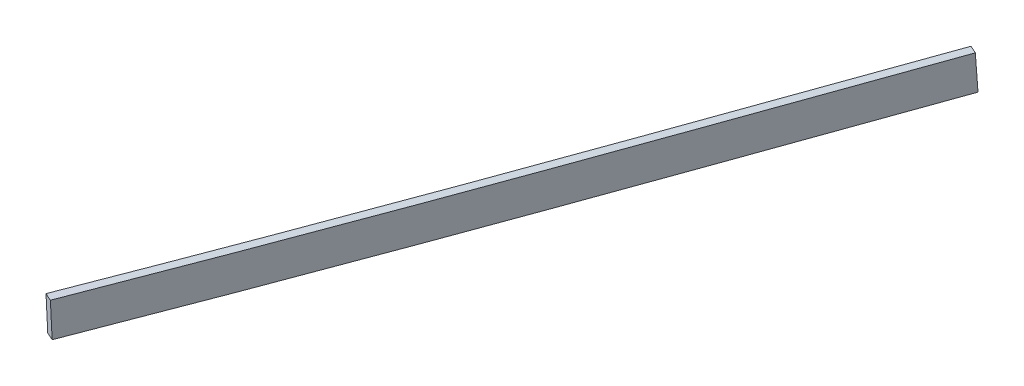
from build123d import *

# Parameters (mm, degrees)
BOSS_EXTRUDE1_DEPTH = 3.175


with BuildPart() as part:
    # Sketch1 → Boss-Extrude1 (new body)
    with BuildSketch(Plane(origin=(190.505997168, 0, 85.025834525), x_dir=(-0.40756496353562105, 0, 0.9131762154689576), z_dir=(-0.9131762154689574, 0, -0.407564963535621))):
        with BuildLine():
            Line((-194.161779339, 51.627918831), (-194.650224224, 38.937315157))
            add(Edge.make_bspline(
                [(-194.650224224, 38.937315157), (-216.120226949, 39.763667731), (-259.053374571, 41.595801952), (-323.427730174, 44.905224632), (-377.019673006, 48.064558301), (-419.851772465, 50.681023549), (-441.23437363, 51.969800569), (-451.931215625, 52.593577963)],
                knots=[0.027275816, 0.027275816, 0.027275816, 0.027275816, 0.270456862, 0.513637908, 0.756818954, 0.878409477, 1, 1, 1, 1], degree=3))
            Line((-451.931215625, 52.593577963), (-451.191881748, 65.27203944))
            add(Edge.make_bspline(
                [(-194.161779339, 51.627918831), (-213.792743003, 52.383489175), (-233.420512404, 53.21399507), (-275.072666238, 55.143061948), (-297.095773537, 56.2627633), (-341.132344654, 58.673615561), (-363.145997588, 59.966397282), (-396.163073976, 61.958190876), (-407.168280906, 62.630239457), (-429.179183458, 63.966160817), (-440.18487064, 64.630174794), (-451.191881748, 65.27203944)],
                knots=[0.027275816, 0.027275816, 0.027275816, 0.027275816, 0.25, 0.25, 0.5, 0.5, 0.75, 0.75, 0.875, 0.875, 1, 1, 1, 1], degree=3))
        make_face()
    extrude(amount=BOSS_EXTRUDE1_DEPTH)


solid = part.part
